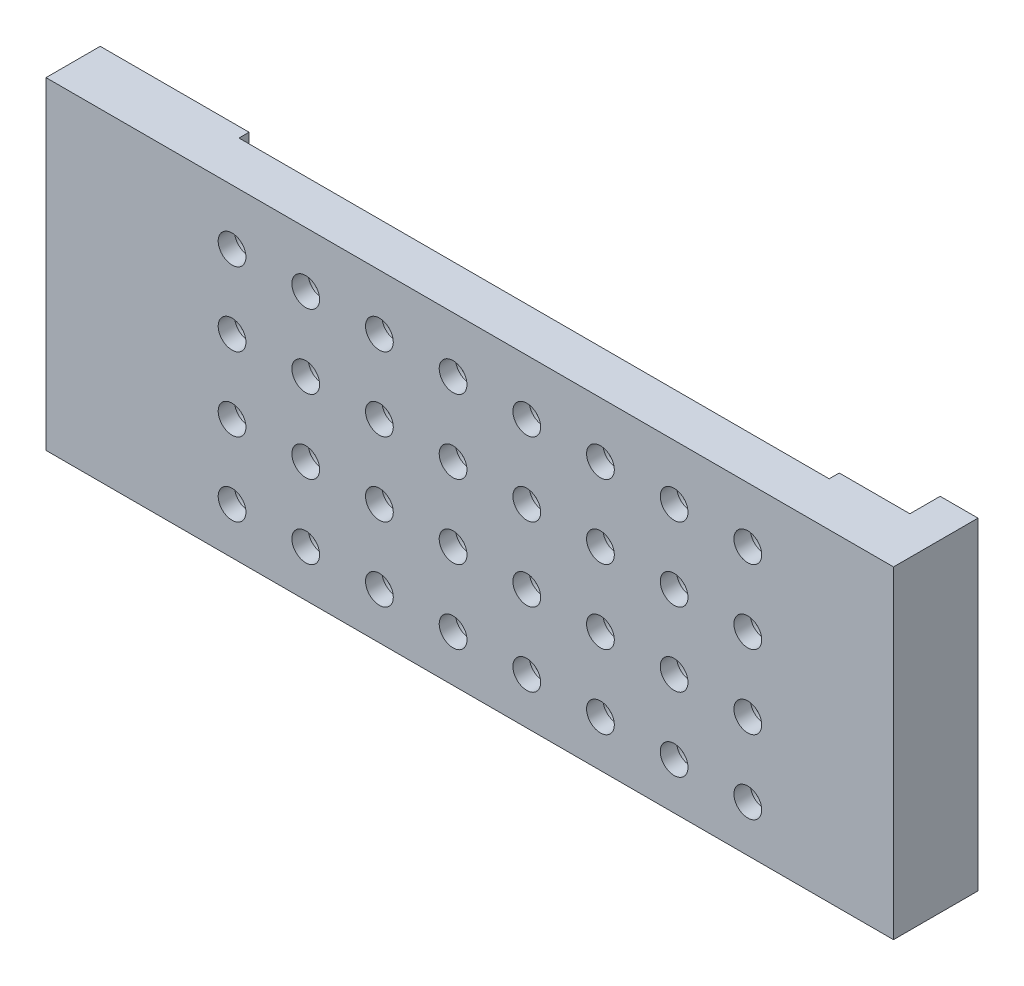
from build123d import *

# Parameters (mm, degrees)
SIDE_PROFILE_DEPTH        = 168
SKETCH5_R                 = 2.75
TUBE_HOLES_DEPTH          = 172.244160484
SKETCH7_W                 = 7.5
SKETCH7_H                 = 64
EDGE_2_DEPTH              = 8.75
SKETCH9_W                 = 14.5
SKETCH9_H                 = 64
SKETCH9_W_2               = 29.5
SKETCH9_H_2               = 8
SLIDER_HELPER_DEPTH       = 2
SKETCH6_R                 = 0.79375
MAGNET_HOLES_MAIN_DEPTH   = 4.5
SKETCH8_R                 = 0.79375
MAGNET_HOLES_DIVET_DEPTH  = 4.5
SKETCH10_R                = 0.79375
MAGNET_HOLES_HELPER_DEPTH = 4.5
SKETCH12_R                = 2.5
LEGO_HOLES_BOTTOM_DEPTH   = 2
O_RING_START              = -4
SKETCH13_R                = 4
O_RING_HOLES_DEPTH        = 0.75


with BuildPart() as part:
    # Sketch4 → Side Profile (new body)
    with BuildSketch(Plane.ZY):
        Polygon((8, 32), (16.75, 32), (16.75, -32), (8, -32), (8, -27.5), (8.75, -27.5), (8.75, 27.5), (8, 27.5), align=None)
    extrude(amount=-SIDE_PROFILE_DEPTH)

    # Sketch5 → Tube Holes (cut, through all)
    with BuildSketch(Plane.XY.offset(16.75)):
        with Locations((36.8825, -22.8)):
            Circle(SKETCH5_R)
        with Locations((51.4875, -22.8)):
            Circle(SKETCH5_R)
        with Locations((66.0925, -22.8)):
            Circle(SKETCH5_R)
        with Locations((80.6975, -22.8)):
            Circle(SKETCH5_R)
        with Locations((95.3025, -22.8)):
            Circle(SKETCH5_R)
        with Locations((109.9075, -22.8)):
            Circle(SKETCH5_R)
        with Locations((124.5125, -22.8)):
            Circle(SKETCH5_R)
        with Locations((139.1175, -22.8)):
            Circle(SKETCH5_R)
        with Locations((51.4875, -8.195)):
            Circle(SKETCH5_R)
        with Locations((66.0925, -8.195)):
            Circle(SKETCH5_R)
        with Locations((80.6975, -8.195)):
            Circle(SKETCH5_R)
        with Locations((95.3025, -8.195)):
            Circle(SKETCH5_R)
        with Locations((109.9075, -8.195)):
            Circle(SKETCH5_R)
        with Locations((124.5125, -8.195)):
            Circle(SKETCH5_R)
        with Locations((139.1175, -8.195)):
            Circle(SKETCH5_R)
        with Locations((51.4875, 6.41)):
            Circle(SKETCH5_R)
        with Locations((66.0925, 6.41)):
            Circle(SKETCH5_R)
        with Locations((80.6975, 6.41)):
            Circle(SKETCH5_R)
        with Locations((95.3025, 6.41)):
            Circle(SKETCH5_R)
        with Locations((109.9075, 6.41)):
            Circle(SKETCH5_R)
        with Locations((124.5125, 6.41)):
            Circle(SKETCH5_R)
        with Locations((139.1175, 6.41)):
            Circle(SKETCH5_R)
        with Locations((51.4875, 21.015)):
            Circle(SKETCH5_R)
        with Locations((66.0925, 21.015)):
            Circle(SKETCH5_R)
        with Locations((80.6975, 21.015)):
            Circle(SKETCH5_R)
        with Locations((95.3025, 21.015)):
            Circle(SKETCH5_R)
        with Locations((109.9075, 21.015)):
            Circle(SKETCH5_R)
        with Locations((124.5125, 21.015)):
            Circle(SKETCH5_R)
        with Locations((139.1175, 21.015)):
            Circle(SKETCH5_R)
        with Locations((36.8825, -8.195)):
            Circle(SKETCH5_R)
        with Locations((36.8825, 6.41)):
            Circle(SKETCH5_R)
        with Locations((36.8825, 21.015)):
            Circle(SKETCH5_R)
    extrude(amount=-TUBE_HOLES_DEPTH, mode=Mode.SUBTRACT)

    # Sketch7 → Edge 2 (add)
    with BuildSketch(Plane(origin=(0, 0, 8.75), x_dir=(-1, 0, 0), z_dir=(0, 0, -1))):
        with Locations((-164.25, 0)):
            Rectangle(SKETCH7_W, SKETCH7_H)
    extrude(amount=EDGE_2_DEPTH)

    # Sketch9 → Slider Helper (add)
    with BuildSketch(Plane(origin=(0, 0, 8), x_dir=(-1, 0, 0), z_dir=(0, 0, -1))):
        with Locations((-153.75, 0)):
            Rectangle(SKETCH9_W, SKETCH9_H)
        with Locations((-14.75, 28)):
            Rectangle(SKETCH9_W_2, SKETCH9_H_2)
        with Locations((-14.75, -28)):
            Rectangle(SKETCH9_W_2, SKETCH9_H_2)
    extrude(amount=SLIDER_HELPER_DEPTH)

    # Sketch6 → Magnet Holes (main) (cut)
    with BuildSketch(Plane(origin=(0, 0, 8), x_dir=(-1, 0, 0), z_dir=(0, 0, -1))):
        with Locations((-88, -29.75)):
            Circle(SKETCH6_R)
        with Locations((-128, 29.75)):
            Circle(SKETCH6_R)
        with Locations((-128, -29.75)):
            Circle(SKETCH6_R)
        with Locations((-46, -29.75)):
            Circle(SKETCH6_R)
        with Locations((-46, 29.75)):
            Circle(SKETCH6_R)
        with Locations((-88, 29.75)):
            Circle(SKETCH6_R)
    extrude(amount=-MAGNET_HOLES_MAIN_DEPTH, mode=Mode.SUBTRACT)

    # Sketch8 → Magnet Holes (divet) (cut)
    with BuildSketch(Plane(origin=(0, 0, 0), x_dir=(-1, 0, 0), z_dir=(0, 0, -1))):
        with Locations((-164, 29.75)):
            Circle(SKETCH8_R)
        with Locations((-164, -29.75)):
            Circle(SKETCH8_R)
        with Locations((-164, 0)):
            Circle(SKETCH8_R)
    extrude(amount=-MAGNET_HOLES_DIVET_DEPTH, mode=Mode.SUBTRACT)

    # Sketch10 → Magnet Holes (helper) (cut)
    with BuildSketch(Plane(origin=(0, 0, 6), x_dir=(-1, 0, 0), z_dir=(0, 0, -1))):
        with Locations((-153, 29.75)):
            Circle(SKETCH10_R)
        with Locations((-153, -29.75)):
            Circle(SKETCH10_R)
        with Locations((-4, 29.75)):
            Circle(SKETCH10_R)
        with Locations((-4, -29.75)):
            Circle(SKETCH10_R)
    extrude(amount=-MAGNET_HOLES_HELPER_DEPTH, mode=Mode.SUBTRACT)

    # Sketch12 → Lego Holes (bottom) (cut)
    with BuildSketch(Plane.XZ.offset(32)):
        with Locations(Location((164, 12.75, 0), (0, 0, 270))):
            Circle(SKETCH12_R)
        with Locations(Location((148, 12.75, 0), (0, 0, 270))):
            Circle(SKETCH12_R)
        with Locations(Location((140, 12.75, 0), (0, 0, 270))):
            Circle(SKETCH12_R)
        with Locations(Location((116, 12.75, 0), (0, 0, 270))):
            Circle(SKETCH12_R)
        with Locations(Location((108, 12.75, 0), (0, 0, 270))):
            Circle(SKETCH12_R)
        with Locations(Location((100, 12.75, 0), (0, 0, 270))):
            Circle(SKETCH12_R)
        with Locations(Location((76, 12.75, 0), (0, 0, 270))):
            Circle(SKETCH12_R)
        with Locations(Location((68, 12.75, 0), (0, 0, 270))):
            Circle(SKETCH12_R)
        with Locations(Location((60, 12.75, 0), (0, 0, 270))):
            Circle(SKETCH12_R)
        with Locations(Location((52, 12.75, 0), (0, 0, 270))):
            Circle(SKETCH12_R)
        with Locations(Location((36, 12.75, 0), (0, 0, 270))):
            Circle(SKETCH12_R)
        with Locations(Location((28, 12.75, 0), (0, 0, 270))):
            Circle(SKETCH12_R)
        with Locations(Location((20, 12.75, 0), (0, 0, 270))):
            Circle(SKETCH12_R)
        with Locations(Location((12, 12.75, 0), (0, 0, 270))):
            Circle(SKETCH12_R)
    extrude(amount=-LEGO_HOLES_BOTTOM_DEPTH, mode=Mode.SUBTRACT)

    # Sketch13 → O-Ring Holes (cut, symmetric)
    with BuildSketch(Plane.XY.offset(16.75).offset(O_RING_START)):
        with Locations((36.8825, -22.8)):
            Circle(SKETCH13_R)
        with Locations((51.4875, -22.8)):
            Circle(SKETCH13_R)
        with Locations((66.0925, -22.8)):
            Circle(SKETCH13_R)
        with Locations((80.6975, -22.8)):
            Circle(SKETCH13_R)
        with Locations((95.3025, -22.8)):
            Circle(SKETCH13_R)
        with Locations((109.9075, -22.8)):
            Circle(SKETCH13_R)
        with Locations((124.5125, -22.8)):
            Circle(SKETCH13_R)
        with Locations((139.1175, -22.8)):
            Circle(SKETCH13_R)
        with Locations((51.4875, -8.195)):
            Circle(SKETCH13_R)
        with Locations((66.0925, -8.195)):
            Circle(SKETCH13_R)
        with Locations((80.6975, -8.195)):
            Circle(SKETCH13_R)
        with Locations((95.3025, -8.195)):
            Circle(SKETCH13_R)
        with Locations((109.9075, -8.195)):
            Circle(SKETCH13_R)
        with Locations((124.5125, -8.195)):
            Circle(SKETCH13_R)
        with Locations((139.1175, -8.195)):
            Circle(SKETCH13_R)
        with Locations((51.4875, 6.41)):
            Circle(SKETCH13_R)
        with Locations((66.0925, 6.41)):
            Circle(SKETCH13_R)
        with Locations((80.6975, 6.41)):
            Circle(SKETCH13_R)
        with Locations((95.3025, 6.41)):
            Circle(SKETCH13_R)
        with Locations((109.9075, 6.41)):
            Circle(SKETCH13_R)
        with Locations((124.5125, 6.41)):
            Circle(SKETCH13_R)
        with Locations((139.1175, 6.41)):
            Circle(SKETCH13_R)
        with Locations((51.4875, 21.015)):
            Circle(SKETCH13_R)
        with Locations((66.0925, 21.015)):
            Circle(SKETCH13_R)
        with Locations((80.6975, 21.015)):
            Circle(SKETCH13_R)
        with Locations((95.3025, 21.015)):
            Circle(SKETCH13_R)
        with Locations((109.9075, 21.015)):
            Circle(SKETCH13_R)
        with Locations((124.5125, 21.015)):
            Circle(SKETCH13_R)
        with Locations((139.1175, 21.015)):
            Circle(SKETCH13_R)
        with Locations((36.8825, -8.195)):
            Circle(SKETCH13_R)
        with Locations((36.8825, 6.41)):
            Circle(SKETCH13_R)
        with Locations((36.8825, 21.015)):
            Circle(SKETCH13_R)
    extrude(amount=O_RING_HOLES_DEPTH, both=True, mode=Mode.SUBTRACT)


solid = part.part
